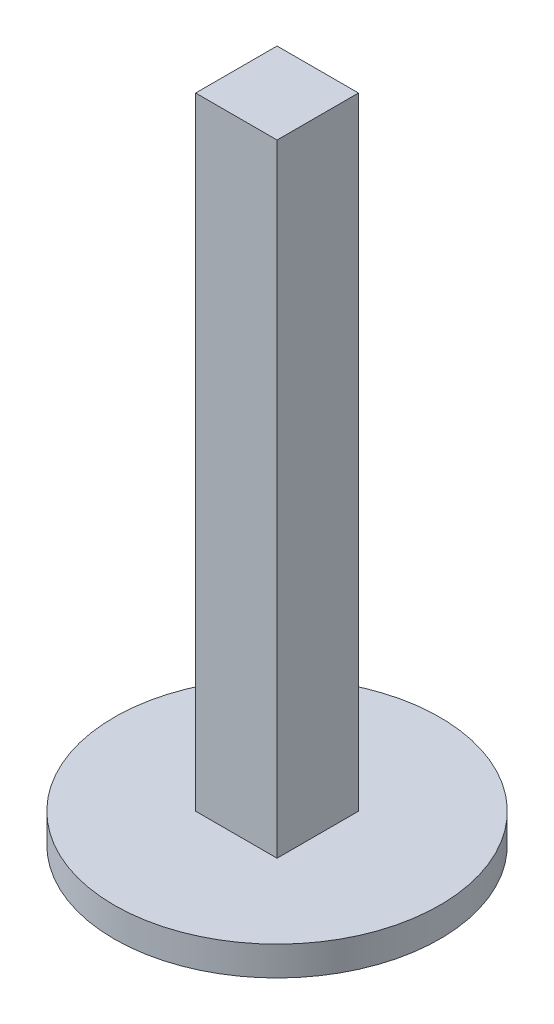
from build123d import *

# Parameters (mm, degrees)
SKETCH3_R           = 12.7
BOSS_EXTRUDE4_DEPTH = 2.286
SKETCH7_W           = 6.35
SKETCH7_H           = 6.35
BOSS_EXTRUDE5_DEPTH = 50.8


with BuildPart() as part:
    # Sketch3 → Boss-Extrude4 (new body)
    with BuildSketch(Plane(origin=(0, 0, 0), x_dir=(1, 0, 0), z_dir=(0, 1, 0))):
        with Locations(Location((0, 0, 0), (0, 0, 270))):
            Circle(SKETCH3_R)
    extrude(amount=BOSS_EXTRUDE4_DEPTH)

    # Sketch7 → Boss-Extrude5 (add)
    with BuildSketch(Plane(origin=(0, 0, 0), x_dir=(1, 0, 0), z_dir=(0, 1, 0))):
        Rectangle(SKETCH7_W, SKETCH7_H)
    extrude(amount=BOSS_EXTRUDE5_DEPTH)


solid = part.part
